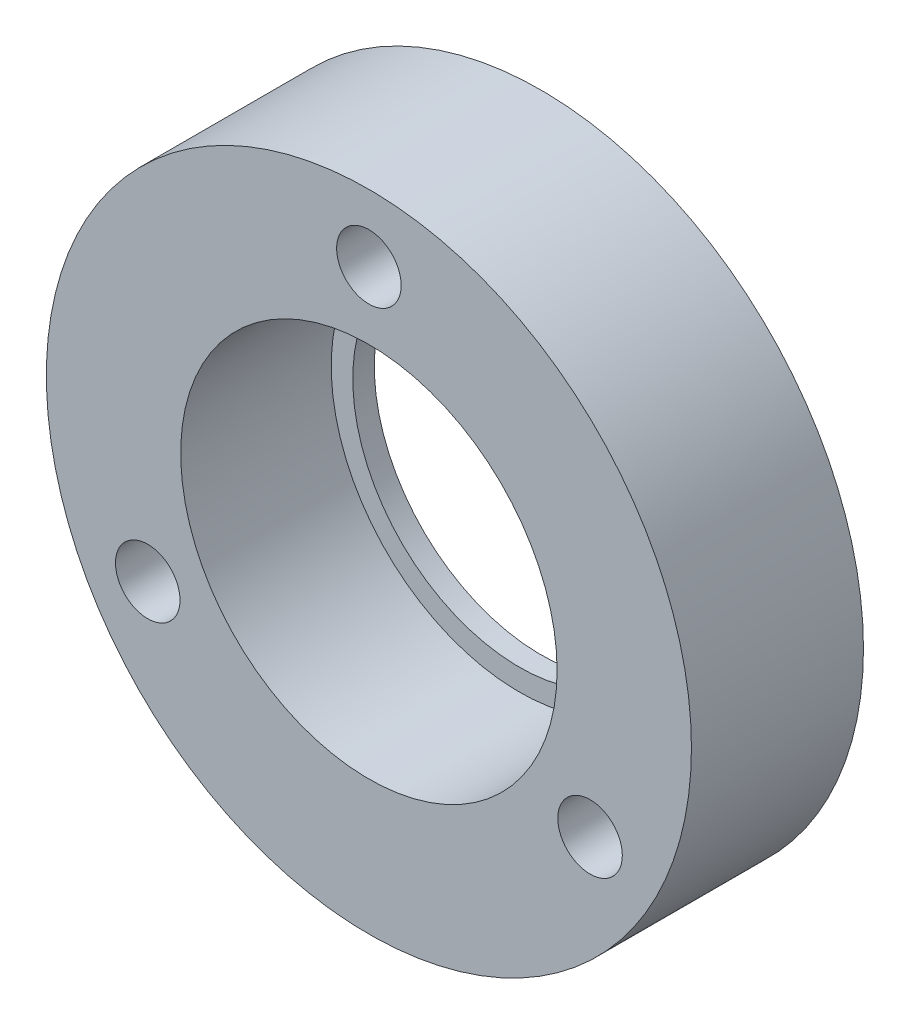
from build123d import *

# Parameters (mm, degrees)
SKETCH1_R           = 30
BOSS_EXTRUDE1_DEPTH = 16
SKETCH2_R           = 17.505
CUT_EXTRUDE1_DEPTH  = 14
SKETCH4_R           = 15.5
CUT_EXTRUDE2_DEPTH  = 45.676615807
SKETCH5_R           = 3
CUT_EXTRUDE3_DEPTH  = 46.343136195


with BuildPart() as part:
    # Sketch1 → Boss-Extrude1 (new body)
    with BuildSketch(Plane.XY):
        Circle(SKETCH1_R)
    extrude(amount=BOSS_EXTRUDE1_DEPTH)

    # Sketch2 → Cut-Extrude1 (cut)
    with BuildSketch(Plane.XY.offset(16)):
        Circle(SKETCH2_R)
    extrude(amount=-CUT_EXTRUDE1_DEPTH, mode=Mode.SUBTRACT)

    # Sketch4 → Cut-Extrude2 (cut, through all)
    with BuildSketch(Plane.XY.offset(2)):
        Circle(SKETCH4_R)
    extrude(amount=-CUT_EXTRUDE2_DEPTH, mode=Mode.SUBTRACT)

    # Sketch5 → Cut-Extrude3 (cut, through all)
    with BuildSketch(Plane.XY.offset(16)):
        with Locations((0, 23.7525)):
            Circle(SKETCH5_R)
        with Locations((20.570268403, -11.87625)):
            Circle(SKETCH5_R)
        with Locations((-20.570268403, -11.87625)):
            Circle(SKETCH5_R)
    extrude(amount=-CUT_EXTRUDE3_DEPTH, mode=Mode.SUBTRACT)


solid = part.part
